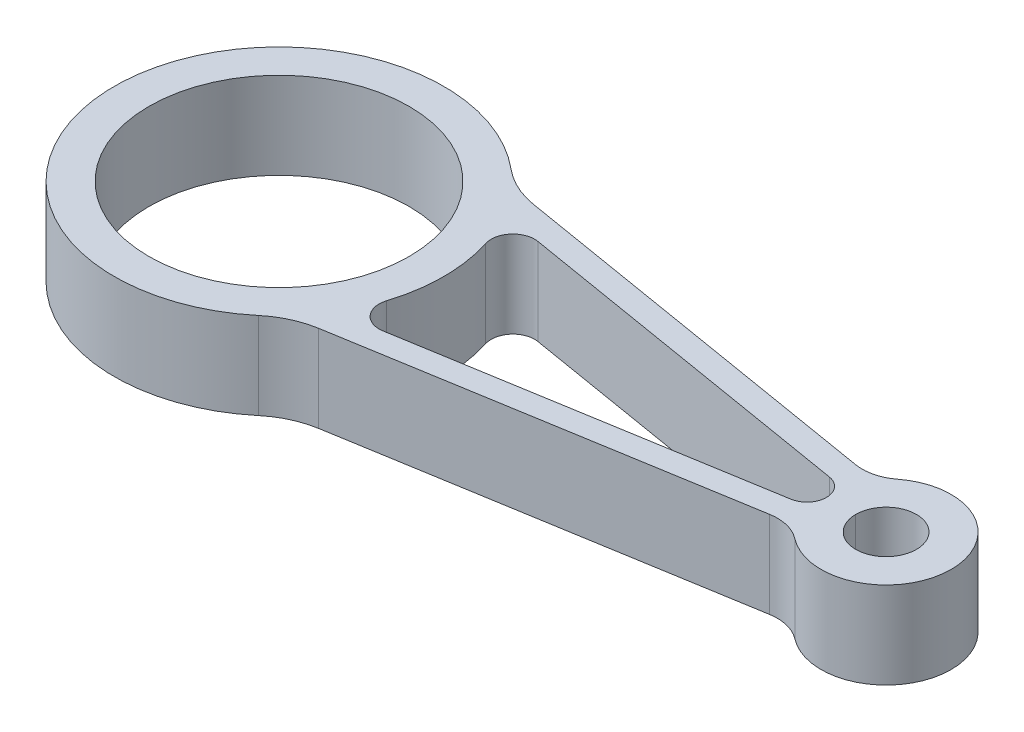
from build123d import *

# Parameters (mm, degrees)
SKETCH1_R           = 30
SKETCH1_R_2         = 7
BOSS_EXTRUDE1_DEPTH = 10
FILLET1_R           = 10
FILLET2_R           = 20
CUT_EXTRUDE1_DEPTH  = 20


with BuildPart() as part:
    # Sketch1 → Boss-Extrude1 (new, symmetric)
    with BuildSketch(Plane(origin=(0, 0, 0), x_dir=(1, 0, 0), z_dir=(0, 1, 0))):
        with BuildLine():
            Line((27.935473676, 25.760615491), (128.063755469, 9.084385863))
            ThreePointArc((128.063755469, 9.084385863), (155, 0), (128.063755469, -9.084385863))
            Line((128.063755469, -9.084385863), (27.935473676, -25.760615491))
            ThreePointArc((27.935473676, -25.760615491), (-38, 0), (27.935473676, 25.760615491))
        make_face()
        with Locations(Location((0, 0, 0), (0, 0, 270))):
            Circle(SKETCH1_R, mode=Mode.SUBTRACT)
        with Locations(Location((140, 0, 0), (0, 0, 270))):
            Circle(SKETCH1_R_2, mode=Mode.SUBTRACT)
    extrude(amount=BOSS_EXTRUDE1_DEPTH, both=True)

    # Fillet1
    fillet1_edges = [part.edges().sort_by_distance(p)[0] for p in [
        (128.063755469, 0, 9.084385863),
        (128.063755469, 0, -9.084385863),
    ]]
    fillet(fillet1_edges, radius=FILLET1_R)

    # Fillet2
    fillet2_edges = [part.edges().sort_by_distance(p)[0] for p in [
        (27.935473676, 0, 25.760615491),
        (27.935473676, 0, -25.760615491),
    ]]
    fillet(fillet2_edges, radius=FILLET2_R)

    # Sketch2 → Cut-Extrude1 (cut)
    with BuildSketch(Plane(origin=(0, 10, 0), x_dir=(1, 0, 0), z_dir=(0, 1, 0))):
        with BuildLine():
            Line((41.828554558, 17.870982725), (122.478416149, 4.438857582))
            ThreePointArc((122.478416149, 4.438857582), (126.239130435, 0), (122.478416149, -4.438857582))
            Line((122.478416149, -4.438857582), (41.828554558, -17.870982725))
            ThreePointArc((41.828554558, -17.870982725), (37.231968897, -16.217361812), (36.238855523, -11.43439331))
            ThreePointArc((36.238855523, -11.43439331), (38, 0), (36.238855523, 11.43439331))
            ThreePointArc((36.238855523, 11.43439331), (37.231968897, 16.217361812), (41.828554558, 17.870982725))
        make_face()
    extrude(amount=-CUT_EXTRUDE1_DEPTH, mode=Mode.SUBTRACT)


solid = part.part
